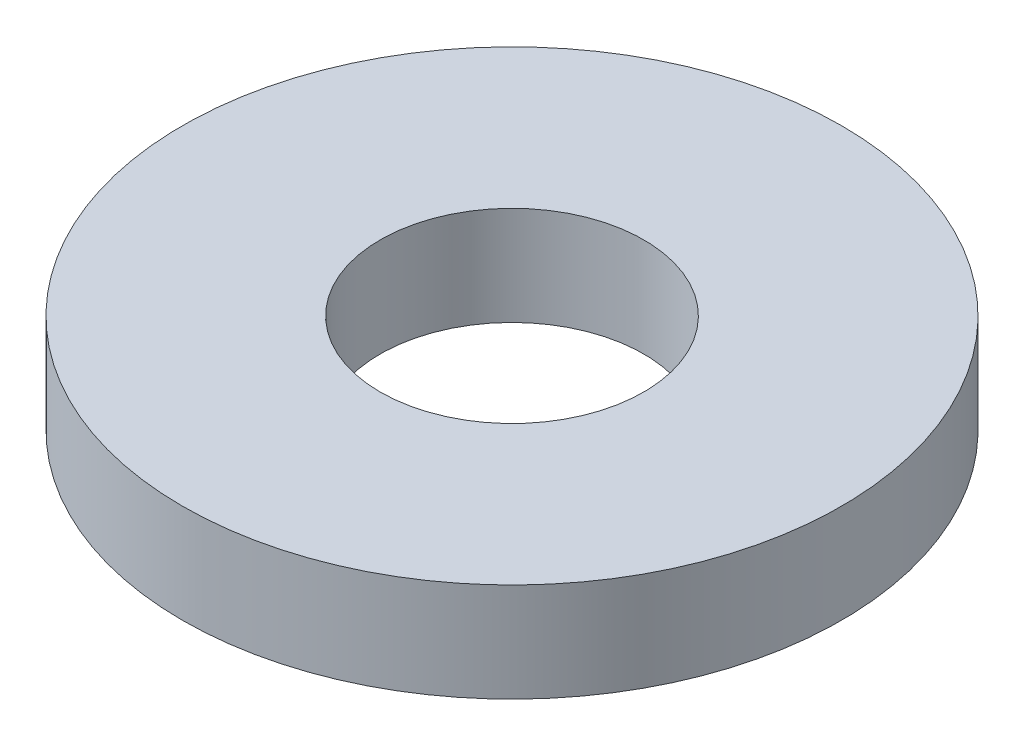
from build123d import *

# Parameters (mm, degrees)
CROQUIS1_R              = 10
CROQUIS1_R_2            = 4
SALIENTE_EXTRUIR1_DEPTH = 3


with BuildPart() as part:
    # Croquis1 → Saliente-Extruir1 (new body)
    with BuildSketch(Plane(origin=(0, 0, 0), x_dir=(1, 0, 0), z_dir=(0, 1, 0))):
        with Locations(Location((0, 0, 0), (0, 0, 270))):
            Circle(CROQUIS1_R)
        with Locations(Location((0, 0, 0), (0, 0, 270))):
            Circle(CROQUIS1_R_2, mode=Mode.SUBTRACT)
    extrude(amount=SALIENTE_EXTRUIR1_DEPTH)


solid = part.part
